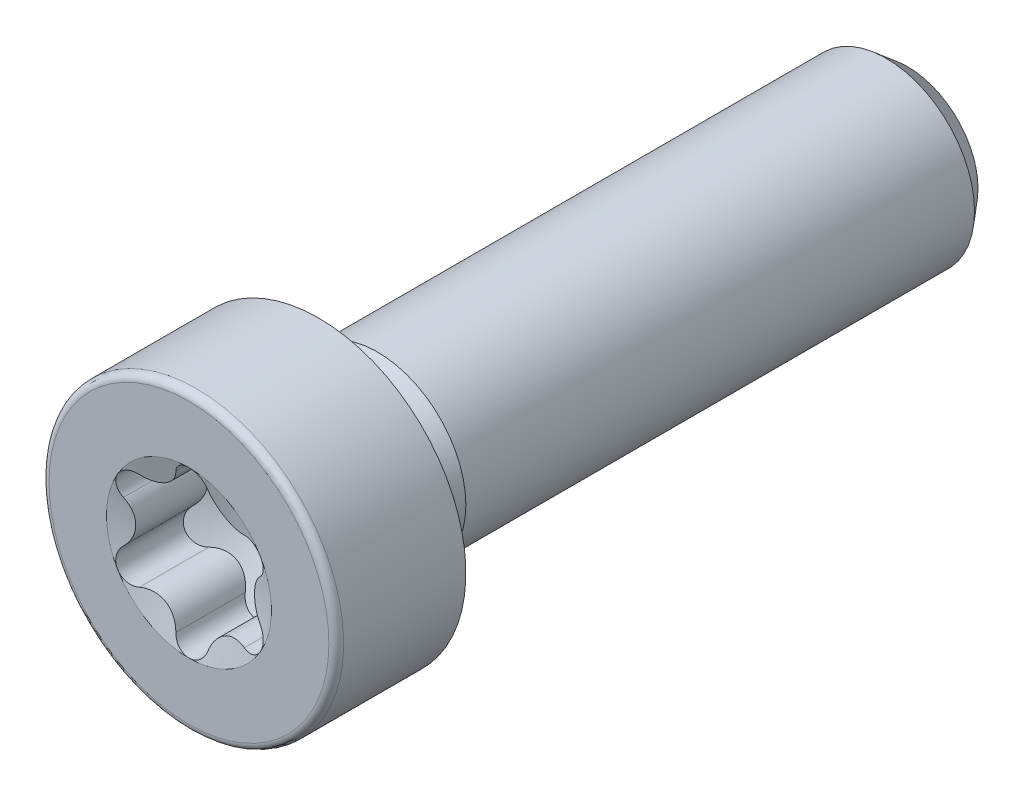
from build123d import *

# Parameters (mm, degrees)
SOCKET_CUT_EXTRUDE1_START  = -3.54
SOCKET_CUT_EXTRUDE1_DEPTH  = 3.54
SKETCH13_R                 = 3
LENGTH_BOSS_EXTRUDE1_DEPTH = 20


with BuildPart() as part:
    # Sketch8 → Head-Revolve1 (revolve)
    with BuildSketch(Plane(origin=(0, 0, 0), x_dir=(0, 0, -1), z_dir=(1, 0, 0))):
        with BuildLine():
            Line((-4.4, 4.75), (-4.4, 2.8))
            Line((-4.4, 2.8), (-4.189927833, 2.016))
            Line((-4.189927833, 2.016), (-4.189927833, 0))
            Line((-4.189927833, 0), (0, 0))
            Line((0, 0), (0, 5))
            Line((0, 5), (-4.15, 5))
            ThreePointArc((-4.15, 5), (-4.326776695, 4.926776695), (-4.4, 4.75))
        make_face()
    revolve(axis=Axis((0, 0, 0), (0, 0, 1)))

    # Sketch9 → socket-Cut-Extrude1 (cut)
    with BuildSketch(Plane.XY.offset(4.4).offset(SOCKET_CUT_EXTRUDE1_START)):
        with BuildLine():
            ThreePointArc((0.544244974, 2.369331508), (1.008, 1.745907214), (1.779778789, 1.655995727))
            ThreePointArc((1.779778789, 1.655995727), (2.424871131, 1.4), (2.324023763, 0.713335781))
            ThreePointArc((2.324023763, 0.713335781), (2.016, 0), (2.324023763, -0.713335781))
            ThreePointArc((2.324023763, -0.713335781), (2.424871131, -1.4), (1.779778789, -1.655995727))
            ThreePointArc((1.779778789, -1.655995727), (1.008, -1.745907214), (0.544244974, -2.369331508))
            ThreePointArc((0.544244974, -2.369331508), (0, -2.8), (-0.544244974, -2.369331508))
            ThreePointArc((-0.544244974, -2.369331508), (-1.008, -1.745907214), (-1.779778789, -1.655995727))
            ThreePointArc((-1.779778789, -1.655995727), (-2.424871131, -1.4), (-2.324023763, -0.713335781))
            ThreePointArc((-2.324023763, -0.713335781), (-2.016, 0), (-2.324023763, 0.713335781))
            ThreePointArc((-2.324023763, 0.713335781), (-2.424871131, 1.4), (-1.779778789, 1.655995727))
            ThreePointArc((-1.779778789, 1.655995727), (-1.008, 1.745907214), (-0.544244974, 2.369331508))
            ThreePointArc((-0.544244974, 2.369331508), (0, 2.8), (0.544244974, 2.369331508))
        make_face()
    extrude(amount=SOCKET_CUT_EXTRUDE1_DEPTH, mode=Mode.SUBTRACT)

    # Sketch12 → Socket-Revolve2 (revolve)
    with BuildSketch(Plane(origin=(0, 0, 0), x_dir=(0, 0, -1), z_dir=(1, 0, 0)), mode=Mode.PRIVATE) as socket_revolve2_sk:
        Polygon((-2.11, 5), (-2.11, 2.8), (-0.86, 0), (0, 0), (0, 5), align=None)
    revolve(socket_revolve2_sk.sketch.rotate(Axis((0, 0, 0), (0, 0, -1)), 90), axis=Axis((0, 0, 0), (0, 0, -1)))

    # Sketch13 → Length-Boss-Extrude1 (add)
    with BuildSketch(Plane.XY):
        Circle(SKETCH13_R)
    extrude(amount=-LENGTH_BOSS_EXTRUDE1_DEPTH)

    # Sketch14 → Runout-Cut-Revolve1 (revolve, cut)
    with BuildSketch(Plane(origin=(0, 0, 0), x_dir=(0, 0, -1), z_dir=(1, 0, 0)), mode=Mode.PRIVATE) as runout_cut_revolve1_sk:
        Polygon((0, 3), (2, 3), (1, 2.675), (0, 2.675), align=None)
    revolve(runout_cut_revolve1_sk.sketch.rotate(Axis((0, 0, 0), (0, 0, -1)), 90), axis=Axis((0, 0, 0), (0, 0, -1)), mode=Mode.SUBTRACT)

    # Sketch15 → Fillet-Revolve3 (revolve)
    with BuildSketch(Plane(origin=(0, 0, 0), x_dir=(0, 0, -1), z_dir=(1, 0, 0)), mode=Mode.PRIVATE) as fillet_revolve3_sk:
        with BuildLine():
            ThreePointArc((0.146390721, 3.0375), (0.536304234, 2.769379359), (1, 2.675))
            Line((1, 2.675), (0, 2.675))
            Line((0, 2.675), (0, 3.4))
            ThreePointArc((0, 3.4), (0.037979272, 3.204528459), (0.146390721, 3.0375))
        make_face()
    revolve(fillet_revolve3_sk.sketch.rotate(Axis((0, 0, 0), (0, 0, -1)), 90), axis=Axis((0, 0, 0), (0, 0, -1)))

    # Sketch16 → Chamfer-Cut-Revolve2 (revolve, cut)
    with BuildSketch(Plane(origin=(0, 0, 0), x_dir=(0, 0, -1), z_dir=(1, 0, 0)), mode=Mode.PRIVATE) as chamfer_cut_revolve2_sk:
        Polygon((20, 3), (19.268859171, 3), (20, 2.3865), align=None)
    revolve(chamfer_cut_revolve2_sk.sketch.rotate(Axis((0, 0, 0), (0, 0, -1)), 90), axis=Axis((0, 0, 0), (0, 0, -1)), mode=Mode.SUBTRACT)


solid = part.part
